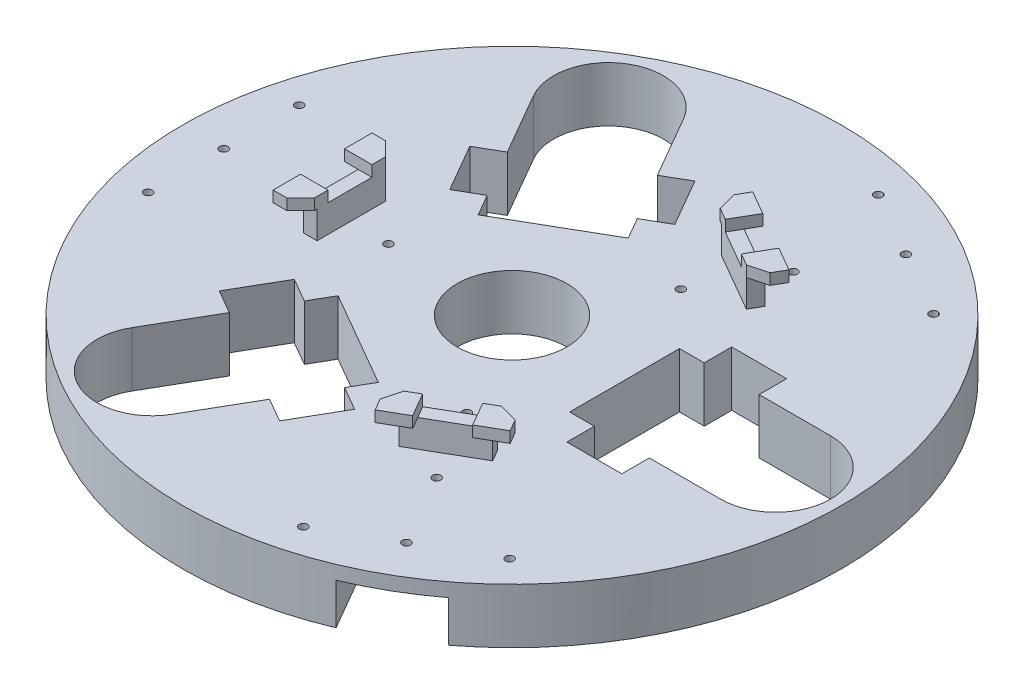
from build123d import *

# Parameters (mm, degrees)
SKETCH_1_R               = 120
EXTRUDE_1_DEPTH          = 20
CUT_EXTRUDE_1_DEPTH      = 171.880074906
CUT_EXTRUDE_1_DEPTH_BACK = 171.880074906
SKETCH_2_R               = 15
CUT_EXTRUDE_2_DEPTH      = 15
PATTERN_CIRCULAR_1_COUNT = 3
SKETCH_5_R               = 1.5
CUT_EXTRUDE_3_DEPTH      = 171.880074906
PATTERN_CIRCULAR_2_COUNT = 3
CUT_EXTRUDE_4_DEPTH      = 171.880074906
PATTERN_CIRCULAR_3_COUNT = 3
SKETCH_7_R               = 20
CUT_EXTRUDE_5_DEPTH      = 171.880074906
SKETCH_8_R               = 1.5
CUT_EXTRUDE_6_DEPTH      = 171.880074906
PATTERN_CIRCULAR_4_COUNT = 3
SKETCH_12_W              = 5
SKETCH_12_H              = 25
EXTRUDE_3_DEPTH          = 10
EXTRUDE_4_DEPTH          = 4
PATTERN_CIRCULAR_5_COUNT = 3


with BuildPart() as part:
    # 草图1 → 凸台-拉伸1 (new body)
    with BuildSketch(Plane(origin=(0, 0, 0), x_dir=(1, 0, 0), z_dir=(0, 1, 0))):
        Circle(SKETCH_1_R)
    extrude(amount=EXTRUDE_1_DEPTH)

    # 草图2 → 切除-拉伸1 (cut, two sides: drawn at the far end of the back side and taken through both)
    with BuildSketch(Plane(origin=(0, 20, 0), x_dir=(1, 0, 0), z_dir=(0, 1, 0)).offset(-CUT_EXTRUDE_1_DEPTH_BACK)):
        with Locations((60, 0)):
            Circle(SKETCH_2_R)
        with Locations((-30, -51.961524227)):
            Circle(SKETCH_2_R)
        with Locations((-30, 51.961524227)):
            Circle(SKETCH_2_R)
    extrude(amount=CUT_EXTRUDE_1_DEPTH + CUT_EXTRUDE_1_DEPTH_BACK, mode=Mode.SUBTRACT)

    # 草图4 → 切除-拉伸2 (cut)
    with BuildSketch(Plane.XZ):
        Polygon((7.009618943, 42.141016151), (32.990381057, 27.141016151), (82.990381057, 113.74355653), (57.009618943, 128.74355653), align=None)
    cut_extrude_2 = extrude(amount=-CUT_EXTRUDE_2_DEPTH, mode=Mode.SUBTRACT)

    # 阵列(圆周)1: 切除-拉伸2 ×3 about axis
    pattern_circular_1_axis = Axis((0, 0, 0), (0, 1, 0))
    for i in range(1, PATTERN_CIRCULAR_1_COUNT):
        add(cut_extrude_2.rotate(pattern_circular_1_axis, i * 360 / PATTERN_CIRCULAR_1_COUNT), mode=Mode.SUBTRACT)

    # 草图5 → 切除-拉伸3 (cut, symmetric)
    with BuildSketch(Plane.XZ):
        with Locations((-45, 0)):
            Circle(SKETCH_5_R)
        with Locations((-75, 0)):
            Circle(SKETCH_5_R)
        with Locations((-105, 0)):
            Circle(SKETCH_5_R)
    cut_extrude_3 = extrude(amount=CUT_EXTRUDE_3_DEPTH, both=True, mode=Mode.SUBTRACT)

    # 阵列(圆周)2: 切除-拉伸3 ×3 about axis
    pattern_circular_2_axis = Axis((0, 0, 0), (0, 1, 0))
    for i in range(1, PATTERN_CIRCULAR_2_COUNT):
        add(cut_extrude_3.rotate(pattern_circular_2_axis, i * 360 / PATTERN_CIRCULAR_2_COUNT), mode=Mode.SUBTRACT)

    # 草图6 → 切除-拉伸4 (cut, symmetric)
    with BuildSketch(Plane(origin=(0, 20, 0), x_dir=(1, 0, 0), z_dir=(0, 1, 0))):
        with BuildLine():
            Line((41, 20), (41, -20))
            Line((41, -20), (50, -20))
            Line((50, -20), (50, -30))
            Line((50, -30), (70, -30))
            Line((70, -30), (70, -20))
            Line((70, -20), (96, -20))
            ThreePointArc((96, -20), (116, 0), (96, 20))
            Line((96, 20), (70, 20))
            Line((70, 20), (70, 30))
            Line((70, 30), (50, 30))
            Line((50, 30), (50, 20))
            Line((50, 20), (41, 20))
        make_face()
    cut_extrude_4 = extrude(amount=CUT_EXTRUDE_4_DEPTH, both=True, mode=Mode.SUBTRACT)

    # 阵列(圆周)3: 切除-拉伸4 ×3 about axis
    pattern_circular_3_axis = Axis((0, 0, 0), (0, 1, 0))
    for i in range(1, PATTERN_CIRCULAR_3_COUNT):
        add(cut_extrude_4.rotate(pattern_circular_3_axis, i * 360 / PATTERN_CIRCULAR_3_COUNT), mode=Mode.SUBTRACT)

    # 草图7 → 切除-拉伸5 (cut, through all)
    with BuildSketch(Plane(origin=(0, 20, 0), x_dir=(1, 0, 0), z_dir=(0, 1, 0))):
        Circle(SKETCH_7_R)
    extrude(amount=-CUT_EXTRUDE_5_DEPTH, mode=Mode.SUBTRACT)

    # 草图8 → 切除-拉伸6 (cut, symmetric)
    with BuildSketch(Plane(origin=(0, 20, 0), x_dir=(1, 0, 0), z_dir=(0, 1, 0))):
        with Locations((-105, 27.5)):
            Circle(SKETCH_8_R)
        with Locations((-105, -27.5)):
            Circle(SKETCH_8_R)
    cut_extrude_6 = extrude(amount=CUT_EXTRUDE_6_DEPTH, both=True, mode=Mode.SUBTRACT)

    # 阵列(圆周)4: 切除-拉伸6 ×3 about axis
    pattern_circular_4_axis = Axis((0, 0, 0), (0, 1, 0))
    for i in range(1, PATTERN_CIRCULAR_4_COUNT):
        add(cut_extrude_6.rotate(pattern_circular_4_axis, i * 360 / PATTERN_CIRCULAR_4_COUNT), mode=Mode.SUBTRACT)

    # 草图12 → 凸台-拉伸3 (add)
    with BuildSketch(Plane(origin=(0, 20, 0), x_dir=(1, 0, 0), z_dir=(0, 1, 0))):
        with Locations((-61.5, 0.5)):
            Rectangle(SKETCH_12_W, SKETCH_12_H)
    extrude_3 = extrude(amount=EXTRUDE_3_DEPTH)

    # 草图13 → 凸台-拉伸4 (add)
    with BuildSketch(Plane(origin=(0, 30, 0), x_dir=(1, 0, 0), z_dir=(0, 1, 0))):
        Polygon((-69, 8), (-59, 8), (-59, 13), (-64, 18), (-69, 18), align=None)
        Polygon((-59, -13), (-59, -8), (-69, -8), (-69, -18), (-64, -18), align=None)
    extrude_4 = extrude(amount=EXTRUDE_4_DEPTH)

    # 阵列(圆周)5: 凸台-拉伸3, 凸台-拉伸4 ×3 about axis
    pattern_circular_5_axis = Axis((0, 0, 0), (0, 1, 0))
    add([extrude_3.rotate(pattern_circular_5_axis, i * 360 / PATTERN_CIRCULAR_5_COUNT) for i in range(1, PATTERN_CIRCULAR_5_COUNT)])
    add([extrude_4.rotate(pattern_circular_5_axis, i * 360 / PATTERN_CIRCULAR_5_COUNT) for i in range(1, PATTERN_CIRCULAR_5_COUNT)])


solid = part.part
